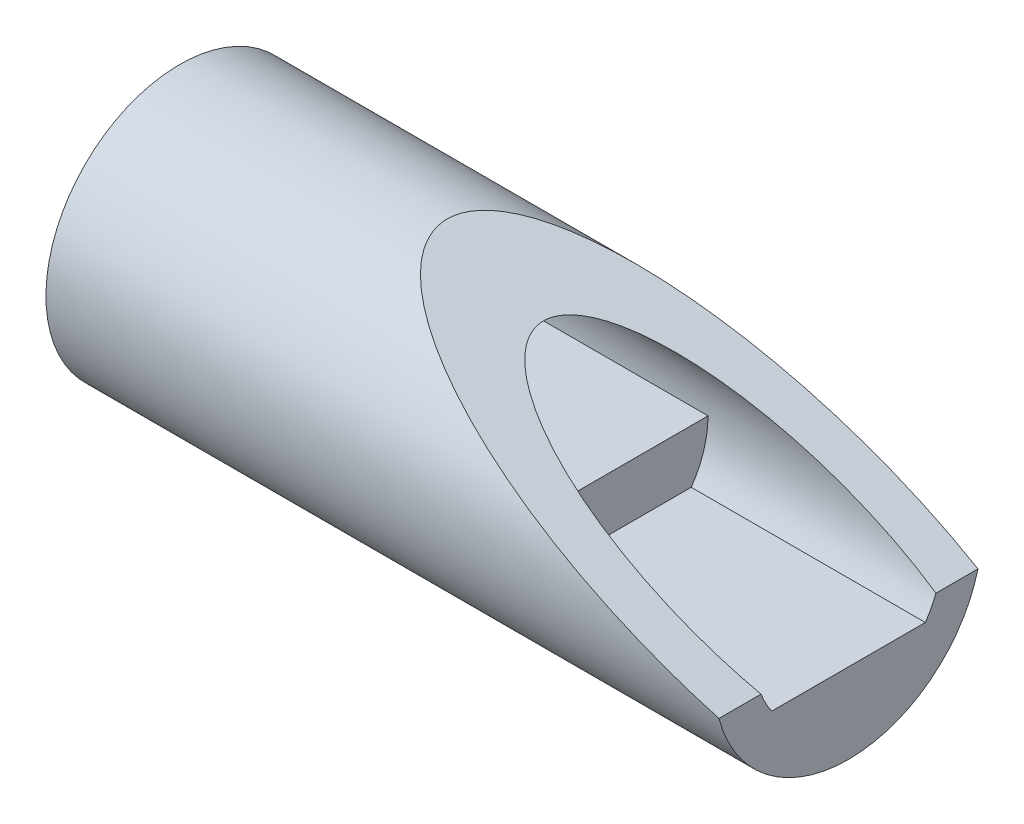
from build123d import *

# Parameters (mm, degrees)
BOSS_EXTRUDE1_DEPTH            = 65
SKETCH1_4_R                    = 20
BOSS_EXTRUDE2_DEPTH            = 100
CUT_EXTRUDE1_REACH             = 105.923
CUT_EXTRUDE1_DIRECTION_2_REACH = 105.923


with BuildPart() as part:
    # Sketch1 → Boss-Extrude1 (new body)
    with BuildSketch(Plane(origin=(0, 0, 0), x_dir=(0, 0, -1), z_dir=(1, 0, 0))):
        with BuildLine():
            Line((14, 0), (-14, 0))
            ThreePointArc((-14, 0), (-13.357540082, -4.192388692), (-11.489125293, -8))
            Line((-11.489125293, -8), (11.489125293, -8))
            ThreePointArc((11.489125293, -8), (13.357540082, -4.192388692), (14, 0))
        make_face()
    extrude(amount=BOSS_EXTRUDE1_DEPTH)

    # Sketch1<4> → Boss-Extrude2 (add)
    with BuildSketch(Plane(origin=(0, 0, 0), x_dir=(0, 0, -1), z_dir=(1, 0, 0))):
        Circle(SKETCH1_4_R)
        with BuildLine():
            Line((11.489125293, -8), (-11.489125293, -8))
            ThreePointArc((-11.489125293, -8), (0, 14), (11.489125293, -8))
        make_face(mode=Mode.SUBTRACT)
    extrude(amount=BOSS_EXTRUDE2_DEPTH)

    # Sketch2 → Cut-Extrude1 (cut, up to next)
    with BuildSketch(Plane.XY, mode=Mode.PRIVATE) as cut_extrude1_sk1:
        Polygon((40, 20), (100, -5), (100, 20), align=None)
    cut_extrude1_tool1 = extrude(cut_extrude1_sk1.sketch, amount=-CUT_EXTRUDE1_REACH, mode=Mode.PRIVATE) & part.part
    add(cut_extrude1_tool1.solids().sort_by_distance((80, 11.666667, 0))[0], mode=Mode.SUBTRACT)

    # Sketch2 → Cut-Extrude1 direction 2 (cut, up to next)
    with BuildSketch(Plane.XY, mode=Mode.PRIVATE) as cut_extrude1_direction_2_sk1:
        Polygon((40, 20), (100, -5), (100, 20), align=None)
    cut_extrude1_direction_2_tool1 = extrude(cut_extrude1_direction_2_sk1.sketch, amount=CUT_EXTRUDE1_DIRECTION_2_REACH, mode=Mode.PRIVATE) & part.part
    add(cut_extrude1_direction_2_tool1.solids().sort_by_distance((80, 11.666667, 0))[0], mode=Mode.SUBTRACT)


solid = part.part
